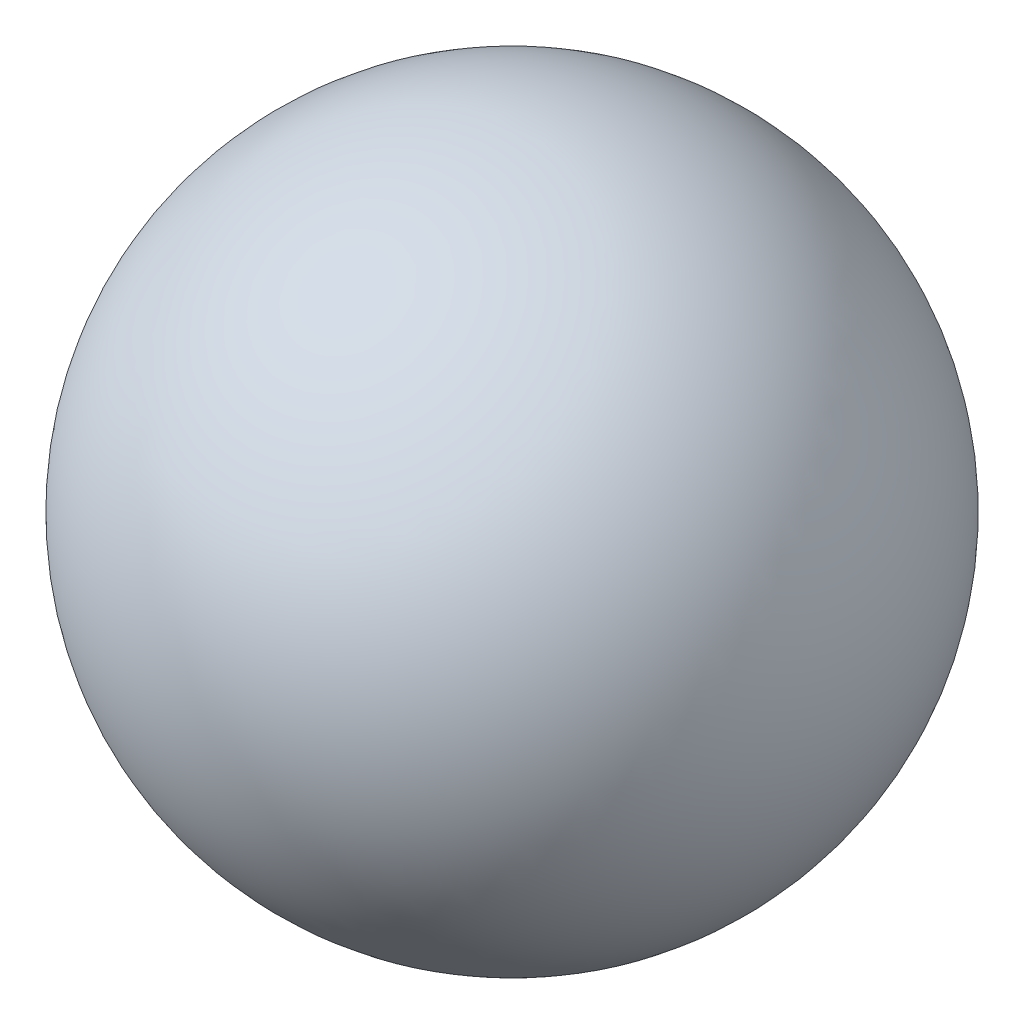
from build123d import *


with BuildPart() as part:
    # 草图1 → 旋转1 (revolve)
    with BuildSketch(Plane.XY):
        with BuildLine():
            Line((0, 21), (0, -21))
            ThreePointArc((0, -21), (21, 0), (0, 21))
        make_face()
    revolve(axis=Axis((0, 21, 0), (0, -1, 0)))


solid = part.part
